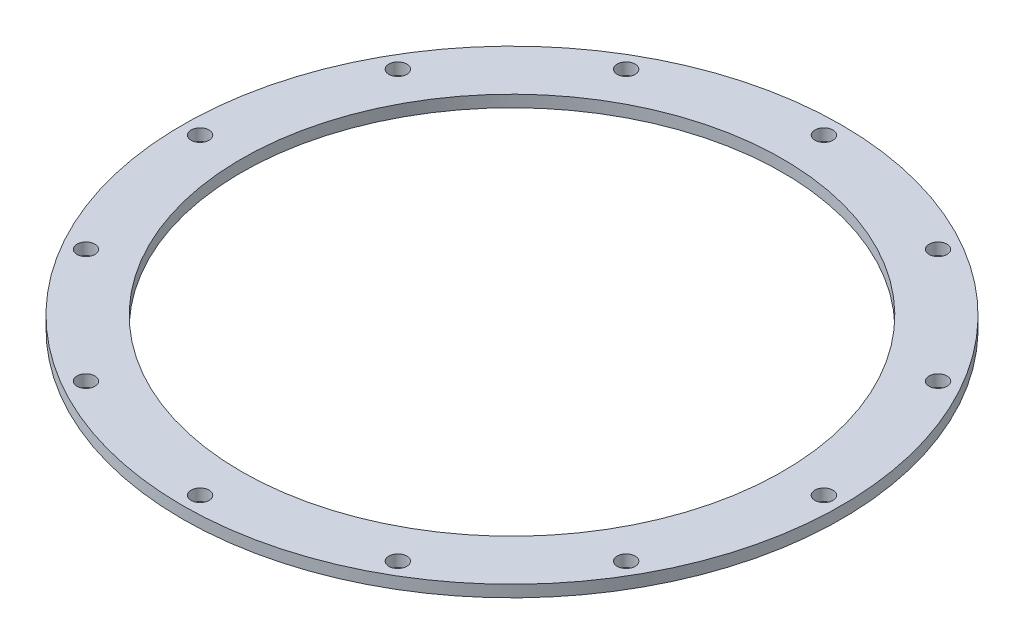
from build123d import *

# Parameters (mm, degrees)
SKETCH_1_R      = 56
SKETCH_1_R_2    = 46
SKETCH_1_R_3    = 1.525
EXTRUDE_1_DEPTH = 2


with BuildPart() as part:
    # 草图1 → 凸台-拉伸1 (new body)
    with BuildSketch(Plane(origin=(0, 0, 0), x_dir=(1, 0, 0), z_dir=(0, 1, 0))):
        with Locations(Location((0, 0, 0), (0, 0, 270))):
            Circle(SKETCH_1_R)
        with Locations(Location((0, 0, 0), (0, 0, 270))):
            Circle(SKETCH_1_R_2, mode=Mode.SUBTRACT)
        with Locations(Location((-53, 0, 0), (0, 0, 270))):
            Circle(SKETCH_1_R_3, mode=Mode.SUBTRACT)
        with Locations(Location((-45.899346401, 26.5, 0), (0, 0, 270))):
            Circle(SKETCH_1_R_3, mode=Mode.SUBTRACT)
        with Locations(Location((-26.5, 45.899346401, 0), (0, 0, 270))):
            Circle(SKETCH_1_R_3, mode=Mode.SUBTRACT)
        with Locations(Location((0, 53, 0), (0, 0, 270))):
            Circle(SKETCH_1_R_3, mode=Mode.SUBTRACT)
        with Locations(Location((26.5, 45.899346401, 0), (0, 0, 270))):
            Circle(SKETCH_1_R_3, mode=Mode.SUBTRACT)
        with Locations(Location((45.899346401, 26.5, 0), (0, 0, 270))):
            Circle(SKETCH_1_R_3, mode=Mode.SUBTRACT)
        with Locations(Location((53, 0, 0), (0, 0, 270))):
            Circle(SKETCH_1_R_3, mode=Mode.SUBTRACT)
        with Locations(Location((45.899346401, -26.5, 0), (0, 0, 270))):
            Circle(SKETCH_1_R_3, mode=Mode.SUBTRACT)
        with Locations(Location((26.5, -45.899346401, 0), (0, 0, 270))):
            Circle(SKETCH_1_R_3, mode=Mode.SUBTRACT)
        with Locations(Location((0, -53, 0), (0, 0, 270))):
            Circle(SKETCH_1_R_3, mode=Mode.SUBTRACT)
        with Locations(Location((-26.5, -45.899346401, 0), (0, 0, 270))):
            Circle(SKETCH_1_R_3, mode=Mode.SUBTRACT)
        with Locations(Location((-45.899346401, -26.5, 0), (0, 0, 270))):
            Circle(SKETCH_1_R_3, mode=Mode.SUBTRACT)
    extrude(amount=EXTRUDE_1_DEPTH)


solid = part.part
